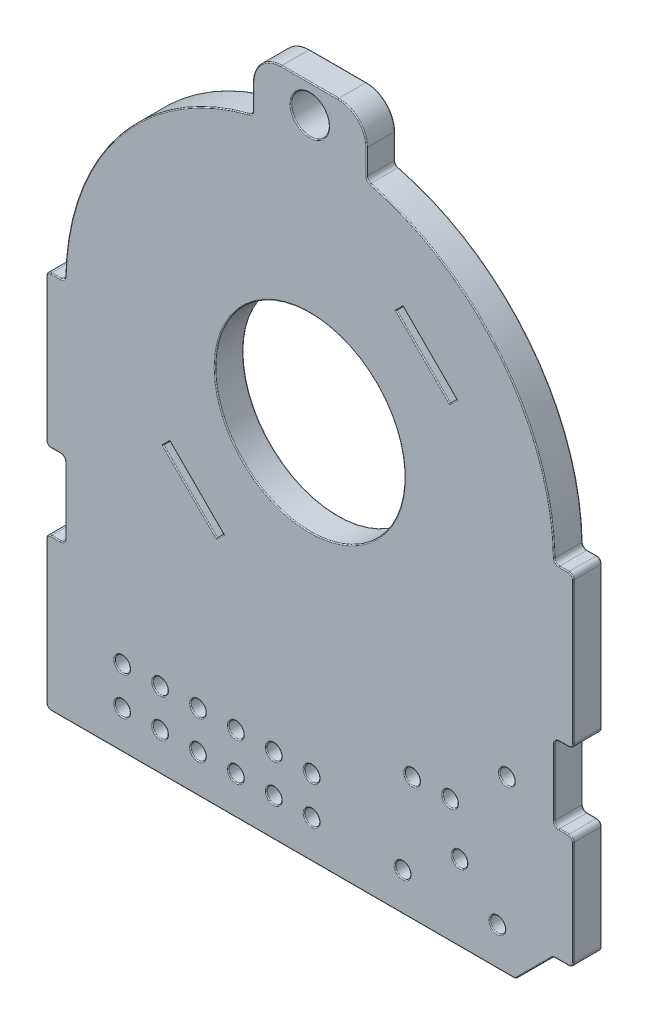
from build123d import *

# Parameters (mm, degrees)
SKETCH1_R           = 0.4
SKETCH1_R_2         = 1
BOSS_EXTRUDE1_DEPTH = 1.5
SKETCH2_R           = 5
CUT_EXTRUDE1_DEPTH  = 25.402049094
FILLET1_R           = 0.05


with BuildPart() as part:
    # Sketch1 → Boss-Extrude1 (new body)
    with BuildSketch(Plane.XY):
        with BuildLine():
            Line((13.147623359, 0), (13.65, 0))
            ThreePointArc((13.65, 0), (13.826776695, -0.073223305), (13.9, -0.25))
            Line((13.9, -0.25), (13.9, -7.75))
            ThreePointArc((13.9, -7.75), (13.826776695, -7.926776695), (13.65, -8))
            Line((13.65, -8), (13.15, -8))
            ThreePointArc((13.15, -8), (12.973223305, -8.073223305), (12.9, -8.25))
            Line((12.9, -8.25), (12.9, -11.75))
            ThreePointArc((12.9, -11.75), (12.973223305, -11.926776695), (13.15, -12))
            Line((13.15, -12), (13.65, -12))
            ThreePointArc((13.65, -12), (13.826776695, -12.073223305), (13.9, -12.25))
            Line((13.9, -12.25), (13.9, -17.75))
            ThreePointArc((13.9, -17.75), (13.826776695, -17.926776695), (13.65, -18))
            Line((13.65, -18), (12.948952708, -18))
            ThreePointArc((12.948952708, -18), (12.85328185, -18.019030117), (12.772176013, -18.073223305))
            Line((12.772176013, -18.073223305), (10.918622622, -19.926776695))
            ThreePointArc((10.918622622, -19.926776695), (10.837516785, -19.980969883), (10.741845927, -20))
            Line((10.741845927, -20), (-13.65, -20))
            ThreePointArc((-13.65, -20), (-13.826776695, -19.926776695), (-13.9, -19.75))
            Line((-13.9, -19.75), (-13.9, -12.25))
            ThreePointArc((-13.9, -12.25), (-13.826776695, -12.073223305), (-13.65, -12))
            Line((-13.65, -12), (-13.15, -12))
            ThreePointArc((-13.15, -12), (-12.973223305, -11.926776695), (-12.9, -11.75))
            Line((-12.9, -11.75), (-12.9, -8.25))
            ThreePointArc((-12.9, -8.25), (-12.973223305, -8.073223305), (-13.15, -8))
            Line((-13.15, -8), (-13.65, -8))
            ThreePointArc((-13.65, -8), (-13.826776695, -7.926776695), (-13.9, -7.75))
            Line((-13.9, -7.75), (-13.9, -0.25))
            ThreePointArc((-13.9, -0.25), (-13.826776695, -0.073223305), (-13.65, 0))
            Line((-13.65, 0), (-13.147623359, 0))
            ThreePointArc((-13.147623359, 0), (-12.972535114, 0.071550829), (-12.897668543, 0.245247148))
            ThreePointArc((-12.897668543, 0.245247148), (-10.111008119, 8.011086994), (-3.188212928, 12.499811932))
            ThreePointArc((-3.188212928, 12.499811932), (-3.052583223, 12.588672465), (-3, 12.742056349))
            Line((-3, 12.742056349), (-3, 14.0463142))
            ThreePointArc((-3, 14.0463142), (-2.560660172, 15.106974372), (-1.5, 15.5463142))
            Line((-1.5, 15.5463142), (1.5, 15.5463142))
            ThreePointArc((1.5, 15.5463142), (2.560660172, 15.106974372), (3, 14.0463142))
            Line((3, 14.0463142), (3, 12.742056349))
            ThreePointArc((3, 12.742056349), (3.052583223, 12.588672465), (3.188212928, 12.499811932))
            ThreePointArc((3.188212928, 12.499811932), (10.111008119, 8.011086994), (12.897668543, 0.245247148))
            ThreePointArc((12.897668543, 0.245247148), (12.972535114, 0.071550829), (13.147623359, 0))
        make_face()
        with Locations((10.4, -11)):
            Circle(SKETCH1_R, mode=Mode.SUBTRACT)
        with Locations((7.9, -16)):
            Circle(SKETCH1_R, mode=Mode.SUBTRACT)
        with Locations((9.9, -18)):
            Circle(SKETCH1_R, mode=Mode.SUBTRACT)
        with Locations((4.9, -18)):
            Circle(SKETCH1_R, mode=Mode.SUBTRACT)
        with Locations((7.4, -13.5)):
            Circle(SKETCH1_R, mode=Mode.SUBTRACT)
        with Locations((5.4, -13.5)):
            Circle(SKETCH1_R, mode=Mode.SUBTRACT)
        with Locations((0, 14.0463142)):
            Circle(SKETCH1_R_2, mode=Mode.SUBTRACT)
        with Locations((0.1, -18)):
            Circle(SKETCH1_R, mode=Mode.SUBTRACT)
        with Locations((-1.9, -18)):
            Circle(SKETCH1_R, mode=Mode.SUBTRACT)
        with Locations((-3.9, -18)):
            Circle(SKETCH1_R, mode=Mode.SUBTRACT)
        with Locations((-5.9, -18)):
            Circle(SKETCH1_R, mode=Mode.SUBTRACT)
        with Locations((-7.9, -18)):
            Circle(SKETCH1_R, mode=Mode.SUBTRACT)
        with Locations((-9.9, -18)):
            Circle(SKETCH1_R, mode=Mode.SUBTRACT)
        with Locations((-1.9, -16)):
            Circle(SKETCH1_R, mode=Mode.SUBTRACT)
        with Locations((-3.9, -16)):
            Circle(SKETCH1_R, mode=Mode.SUBTRACT)
        with Locations((-5.9, -16)):
            Circle(SKETCH1_R, mode=Mode.SUBTRACT)
        with Locations((-7.9, -16)):
            Circle(SKETCH1_R, mode=Mode.SUBTRACT)
        with Locations((-9.9, -16)):
            Circle(SKETCH1_R, mode=Mode.SUBTRACT)
        with Locations((0.1, -16)):
            Circle(SKETCH1_R, mode=Mode.SUBTRACT)
    extrude(amount=BOSS_EXTRUDE1_DEPTH)

    # Sketch2 → Cut-Extrude1 (cut, through all)
    with BuildSketch(Plane.XY.offset(1.5)):
        Circle(SKETCH2_R)
        Polygon((4.560838739, 7.389265863), (4.914392129, 7.742819254), (7.742819254, 4.914392129), (7.389265863, 4.560838739), align=None)
        Polygon((-7.742819254, -4.914392129), (-4.914392129, -7.742819254), (-4.560838739, -7.389265863), (-7.389265863, -4.560838739), align=None)
    extrude(amount=-CUT_EXTRUDE1_DEPTH, mode=Mode.SUBTRACT)

    # Fillet1
    fillet1_edges = [part.edges().sort_by_distance(p)[0] for p in [
        (10.837516785, -19.980969883, 1.5),
        (-13.826776695, -7.926776695, 1.5),
        (4.5, -18, 1.5),
        (-13.4, -8, 1.5),
        (-12.973223305, -8.073223305, 1.5),
        (7, -13.5, 1.5),
        (-12.9, -10, 1.5),
        (5, -13.5, 1.5),
        (-12.973223305, -11.926776695, 1.5),
        (-1, 14.0463142, 1.5),
        (-13.4, -12, 1.5),
        (-13.826776695, -12.073223305, 1.5),
        (-0.3, -18, 1.5),
        (-13.9, -16, 1.5),
        (-2.3, -18, 1.5),
        (-4.3, -18, 1.5),
        (-6.3, -18, 1.5),
        (11.845399317, -19, 1.5),
        (-8.3, -18, 1.5),
        (-10.3, -18, 1.5),
        (-2.3, -16, 1.5),
        (-4.3, -16, 1.5),
        (-6.3, -16, 1.5),
        (-8.3, -16, 1.5),
        (-10.3, -16, 1.5),
        (-0.3, -16, 1.5),
        (12.85328185, -18.019030117, 1.5),
        (-5, 0, 0),
        (-5, 0, 1.5),
        (13.299476354, -18, 1.5),
        (5.975052301, 5.975052301, 1.5),
        (7.566042559, 4.737615434, 1.5),
        (6.328605692, 6.328605692, 1.5),
        (4.737615434, 7.566042559, 1.5),
        (-7.566042559, -4.737615434, 1.5),
        (-6.328605692, -6.328605692, 1.5),
        (-4.737615434, -7.566042559, 1.5),
        (-5.975052301, -5.975052301, 1.5),
        (13.826776695, -17.926776695, 1.5),
        (13.9, -15, 1.5),
        (13.826776695, -12.073223305, 1.5),
        (13.4, -12, 1.5),
        (-13.9, -16, 0),
        (-13.826776695, -12.073223305, 0),
        (12.973223305, -11.926776695, 1.5),
        (-13.4, -12, 0),
        (-12.973223305, -11.926776695, 0),
        (-12.9, -10, 0),
        (-12.973223305, -8.073223305, 0),
        (-13.4, -8, 0),
        (-13.826776695, -7.926776695, 0),
        (-13.9, -4, 0),
        (-13.826776695, -0.073223305, 0),
        (12.9, -10, 1.5),
        (-13.39881168, 0, 0),
        (-12.972535114, 0.071550829, 0),
        (-10.111008119, 8.011086994, 0),
        (-3.052583223, 12.588672465, 0),
        (-3, 13.394185274, 0),
        (-2.560660172, 15.106974372, 0),
        (0, 15.5463142, 0),
        (-13.826776695, -19.926776695, 1.5),
        (12.973223305, -8.073223305, 1.5),
        (2.560660172, 15.106974372, 0),
        (3, 13.394185274, 0),
        (3.052583223, 12.588672465, 0),
        (10.111008119, 8.011086994, 0),
        (12.972535114, 0.071550829, 0),
        (13.39881168, 0, 0),
        (13.826776695, -0.073223305, 0),
        (13.9, -4, 0),
        (13.4, -8, 1.5),
        (13.826776695, -7.926776695, 0),
        (13.4, -8, 0),
        (12.973223305, -8.073223305, 0),
        (12.9, -10, 0),
        (12.973223305, -11.926776695, 0),
        (13.4, -12, 0),
        (13.826776695, -12.073223305, 0),
        (13.826776695, -7.926776695, 1.5),
        (13.9, -15, 0),
        (13.826776695, -17.926776695, 0),
        (13.299476354, -18, 0),
        (12.85328185, -18.019030117, 0),
        (11.845399317, -19, 0),
        (10.837516785, -19.980969883, 0),
        (-1.454077037, -20, 0),
        (-13.826776695, -19.926776695, 0),
        (13.9, -4, 1.5),
        (13.826776695, -0.073223305, 1.5),
        (13.39881168, 0, 1.5),
        (12.972535114, 0.071550829, 1.5),
        (10.111008119, 8.011086994, 1.5),
        (3.052583223, 12.588672465, 1.5),
        (3, 13.394185274, 1.5),
        (-1.454077037, -20, 1.5),
        (2.560660172, 15.106974372, 1.5),
        (0, 15.5463142, 1.5),
        (-2.560660172, 15.106974372, 1.5),
        (-3, 13.394185274, 1.5),
        (-3.052583223, 12.588672465, 1.5),
        (-10.111008119, 8.011086994, 1.5),
        (-12.972535114, 0.071550829, 1.5),
        (-13.39881168, 0, 1.5),
        (10, -11, 1.5),
        (-13.826776695, -0.073223305, 1.5),
        (7.5, -16, 1.5),
        (-13.9, -4, 1.5),
        (9.5, -18, 1.5),
    ]]
    fillet(fillet1_edges, radius=FILLET1_R)


solid = part.part
